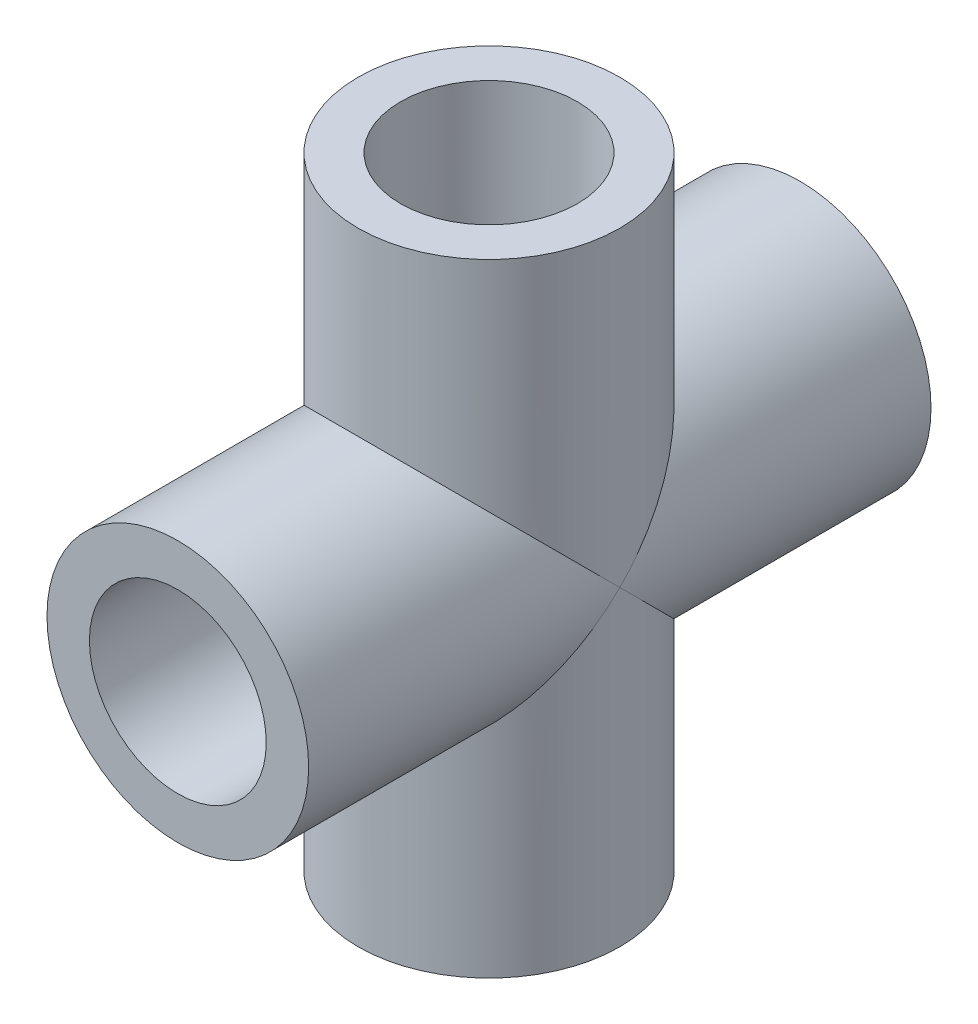
from build123d import *

# Parameters (mm, degrees)
SKETCH1_R           = 9.25
SKETCH1_R_2         = 6.25
EXTRUDE_THIN3_DEPTH = 44
SKETCH3_R           = 9.25
SKETCH3_R_2         = 6.25
EXTRUDE_THIN4_DEPTH = 22


with BuildPart() as part:
    # Sketch1 → Extrude-Thin3 (new body)
    with BuildSketch(Plane.XY):
        Circle(SKETCH1_R)
        Circle(SKETCH1_R_2, mode=Mode.SUBTRACT)
    extrude(amount=EXTRUDE_THIN3_DEPTH)

    # Sketch3 → Extrude-Thin4 (add, symmetric)
    with BuildSketch(Plane(origin=(0, 0, 0), x_dir=(1, 0, 0), z_dir=(0, 1, 0))):
        with Locations((0, -22)):
            Circle(SKETCH3_R)
        with Locations((0, -22)):
            Circle(SKETCH3_R_2, mode=Mode.SUBTRACT)
    extrude(amount=EXTRUDE_THIN4_DEPTH, both=True)


solid = part.part
